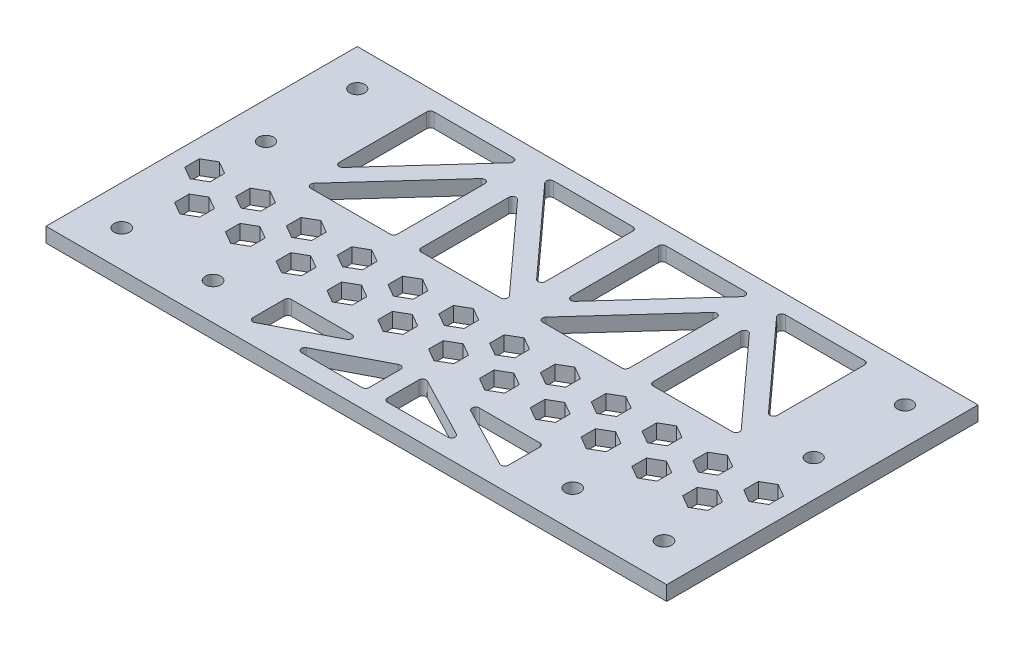
from build123d import *

# Parameters (mm, degrees)
SKETCH_1_W          = 170
SKETCH_1_H          = 85.25
SKETCH_1_R          = 2.05
SKETCH_1_R_2        = 2.1
EXTRUDE_1_DEPTH     = 4
CUT_EXTRUDE_1_DEPTH = 10
CUT_EXTRUDE_2_DEPTH = 10
CUT_EXTRUDE_3_DEPTH = 10
FILLET_1_R          = 1


with BuildPart() as part:
    # 草图1 → 凸台-拉伸1 (new body)
    with BuildSketch(Plane(origin=(0, 0, 0), x_dir=(1, 0, 0), z_dir=(0, 1, 0))):
        with Locations((0, 42.625)):
            Rectangle(SKETCH_1_W, SKETCH_1_H)
        with Locations(Location((-75, 75.25, 0), (0, 0, 270))):
            Circle(SKETCH_1_R, mode=Mode.SUBTRACT)
        with Locations(Location((-75, 50.25, 0), (0, 0, 270))):
            Circle(SKETCH_1_R, mode=Mode.SUBTRACT)
        with Locations(Location((75, 50.25, 0), (0, 0, 90))):
            Circle(SKETCH_1_R, mode=Mode.SUBTRACT)
        with Locations(Location((75, 75.25, 0), (0, 0, 90))):
            Circle(SKETCH_1_R, mode=Mode.SUBTRACT)
        with Locations(Location((74.25, 10, 0), (0, 0, 270))):
            Circle(SKETCH_1_R_2, mode=Mode.SUBTRACT)
        with Locations(Location((49.25, 10, 0), (0, 0, 270))):
            Circle(SKETCH_1_R_2, mode=Mode.SUBTRACT)
        with Locations(Location((-74.25, 10, 0), (0, 0, 90))):
            Circle(SKETCH_1_R_2, mode=Mode.SUBTRACT)
        with Locations(Location((-49.25, 10, 0), (0, 0, 90))):
            Circle(SKETCH_1_R_2, mode=Mode.SUBTRACT)
    extrude(amount=EXTRUDE_1_DEPTH)

    # 草图2 → 切除-拉伸1 (cut)
    with BuildSketch(Plane(origin=(0, 4, 0), x_dir=(1, 0, 0), z_dir=(0, 1, 0))):
        Polygon((-60, 80.25), (-35, 80.25), (-60, 52.691670568), align=None)
        Polygon((-35, 72.808329432), (-60, 45.25), (-35, 45.25), align=None)
        Polygon((35, 45.25), (35, 72.808329432), (60, 45.25), align=None)
        Polygon((60, 52.691670568), (60, 80.25), (35, 80.25), align=None)
        Polygon((-28.5, 45.25), (-28.5, 72.808329432), (-3.5, 45.25), align=None)
        Polygon((-3.5, 52.691670568), (-3.5, 80.25), (-28.5, 80.25), align=None)
        Polygon((3.5, 80.25), (28.5, 80.25), (3.5, 52.691670568), align=None)
        Polygon((28.5, 72.808329432), (3.5, 45.25), (28.5, 45.25), align=None)
    extrude(amount=-CUT_EXTRUDE_1_DEPTH, mode=Mode.SUBTRACT)

    # 草图4 → 切除-拉伸2 (cut)
    with BuildSketch(Plane(origin=(0, 4, 0), x_dir=(1, 0, 0), z_dir=(0, 1, 0))):
        Polygon((-80, 33), (-76.535898385, 31), (-73.07179677, 33), (-73.07179677, 37), (-76.535898385, 39), (-80, 37), align=None)
        Polygon((3.464101615, 23.243590175), (3.464101615, 27.243590175), (0, 29.243590175), (-3.464101615, 27.243590175), (-3.464101615, 23.243590175), (0, 21.243590175), align=None)
        Polygon((-66.084382112, 33), (-62.620280497, 31), (-59.156178882, 33), (-59.156178882, 37), (-62.620280497, 39), (-66.084382112, 37), align=None)
        Polygon((-52.168764224, 33), (-48.704662609, 31), (-45.240560993, 33), (-45.240560993, 37), (-48.704662609, 39), (-52.168764224, 37), align=None)
        Polygon((-38.253146336, 33), (-34.78904472, 31), (-31.324943105, 33), (-31.324943105, 37), (-34.78904472, 39), (-38.253146336, 37), align=None)
        Polygon((-24.337528447, 33), (-20.873426832, 31), (-17.409325217, 33), (-17.409325217, 37), (-20.873426832, 39), (-24.337528447, 37), align=None)
        Polygon((-10.421910559, 33), (-6.957808944, 31), (-3.493707329, 33), (-3.493707329, 37), (-6.957808944, 39), (-10.421910559, 37), align=None)
        Polygon((3.493707329, 33), (6.957808944, 31), (10.421910559, 33), (10.421910559, 37), (6.957808944, 39), (3.493707329, 37), align=None)
        Polygon((17.409325217, 33), (20.873426832, 31), (24.337528447, 33), (24.337528447, 37), (20.873426832, 39), (17.409325217, 37), align=None)
        Polygon((31.324943105, 33), (34.78904472, 31), (38.253146336, 33), (38.253146336, 37), (34.78904472, 39), (31.324943105, 37), align=None)
        Polygon((45.240560993, 33), (48.704662609, 31), (52.168764224, 33), (52.168764224, 37), (48.704662609, 39), (45.240560993, 37), align=None)
        Polygon((59.156178882, 33), (62.620280497, 31), (66.084382112, 33), (66.084382112, 37), (62.620280497, 39), (59.156178882, 37), align=None)
        Polygon((73.07179677, 33), (76.535898385, 31), (80, 33), (80, 37), (76.535898385, 39), (73.07179677, 37), align=None)
        Polygon((-10.451516273, 23.243590175), (-10.451516273, 27.243590175), (-13.915617888, 29.243590175), (-17.379719503, 27.243590175), (-17.379719503, 23.243590175), (-13.915617888, 21.243590175), align=None)
        Polygon((-24.367134161, 23.243590175), (-24.367134161, 27.243590175), (-27.831235776, 29.243590175), (-31.295337391, 27.243590175), (-31.295337391, 23.243590175), (-27.831235776, 21.243590175), align=None)
        Polygon((-38.282752049, 23.243590175), (-38.282752049, 27.243590175), (-41.746853664, 29.243590175), (-45.21095528, 27.243590175), (-45.21095528, 23.243590175), (-41.746853664, 21.243590175), align=None)
        Polygon((-52.198369937, 23.243590175), (-52.198369937, 27.243590175), (-55.662471553, 29.243590175), (-59.126573168, 27.243590175), (-59.126573168, 23.243590175), (-55.662471553, 21.243590175), align=None)
        Polygon((-66.113987826, 23.243590175), (-66.113987826, 27.243590175), (-69.578089441, 29.243590175), (-73.042191056, 27.243590175), (-73.042191056, 23.243590175), (-69.578089441, 21.243590175), align=None)
        Polygon((69.578089441, 21.243590175), (66.113987826, 23.243590175), (66.113987826, 27.243590175), (69.578089441, 29.243590175), (73.042191056, 27.243590175), (73.042191056, 23.243590175), align=None)
        Polygon((55.662471553, 21.243590175), (52.198369937, 23.243590175), (52.198369937, 27.243590175), (55.662471553, 29.243590175), (59.126573168, 27.243590175), (59.126573168, 23.243590175), align=None)
        Polygon((41.746853664, 21.243590175), (38.282752049, 23.243590175), (38.282752049, 27.243590175), (41.746853664, 29.243590175), (45.21095528, 27.243590175), (45.21095528, 23.243590175), align=None)
        Polygon((27.831235776, 21.243590175), (24.367134161, 23.243590175), (24.367134161, 27.243590175), (27.831235776, 29.243590175), (31.295337391, 27.243590175), (31.295337391, 23.243590175), align=None)
        Polygon((13.915617888, 21.243590175), (10.451516273, 23.243590175), (10.451516273, 27.243590175), (13.915617888, 29.243590175), (17.379719503, 27.243590175), (17.379719503, 23.243590175), align=None)
    extrude(amount=-CUT_EXTRUDE_2_DEPTH, mode=Mode.SUBTRACT)

    # 草图5 → 切除-拉伸3 (cut)
    with BuildSketch(Plane(origin=(0, 4, 0), x_dir=(1, 0, 0), z_dir=(0, 1, 0))):
        Polygon((-35, 5), (-35, 16.243590175), (-13.349017121, 16.243590175), align=None)
        Polygon((-24.150982879, 5), (-2.5, 5), (-2.5, 16.243590175), align=None)
        Polygon((2.5, 16.243590175), (24.150982879, 5), (2.5, 5), align=None)
        Polygon((13.349017121, 16.243590175), (35, 5), (35, 16.243590175), align=None)
    extrude(amount=-CUT_EXTRUDE_3_DEPTH, mode=Mode.SUBTRACT)

    # 圆角1
    fillet_1_edges = [part.edges().sort_by_distance(p)[0] for p in [
        (28.5, 2, -72.808329432),
        (28.5, 2, -45.25),
        (3.5, 2, -45.25),
        (3.5, 2, -52.691670568),
        (3.5, 2, -80.25),
        (28.5, 2, -80.25),
        (-3.5, 2, -52.691670568),
        (-28.5, 2, -80.25),
        (-3.5, 2, -80.25),
        (-60, 2, -52.691670568),
        (-60, 2, -80.25),
        (-35, 2, -80.25),
        (-3.5, 2, -45.25),
        (-28.5, 2, -45.25),
        (-28.5, 2, -72.808329432),
        (60, 2, -52.691670568),
        (35, 2, -80.25),
        (60, 2, -80.25),
        (-24.150982879, 2, -5),
        (-2.5, 2, -16.243590175),
        (-2.5, 2, -5),
        (2.5, 2, -5),
        (2.5, 2, -16.243590175),
        (24.150982879, 2, -5),
        (13.349017121, 2, -16.243590175),
        (35, 2, -16.243590175),
        (35, 2, -5),
        (-13.349017121, 2, -16.243590175),
        (-35, 2, -5),
        (-35, 2, -16.243590175),
        (-35, 2, -72.808329432),
        (-35, 2, -45.25),
        (-60, 2, -45.25),
        (60, 2, -45.25),
        (35, 2, -45.25),
        (35, 2, -72.808329432),
    ]]
    fillet(fillet_1_edges, radius=FILLET_1_R)


solid = part.part
